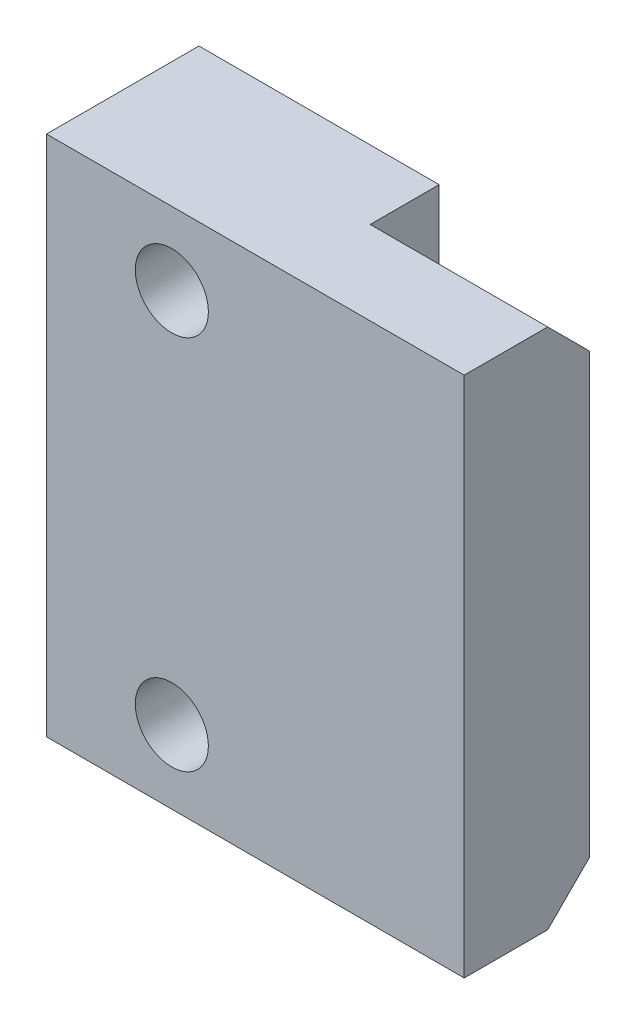
from build123d import *

# Parameters (mm, degrees)
BOSS_EXTRUDE1_DEPTH = 12.5
SKETCH2_R           = 1.75
CUT_EXTRUDE1_DEPTH  = 18.59374889
CHAMFER1_SIZE       = 2


with BuildPart() as part:
    # Sketch1 → Boss-Extrude1 (new, symmetric)
    with BuildSketch(Plane(origin=(0, 0, 0), x_dir=(1, 0, 0), z_dir=(0, 1, 0))):
        Polygon((-10, 7.3), (1.5, 7.3), (1.5, 6), (10, 6), (10, 0), (-10, 0), align=None)
    extrude(amount=BOSS_EXTRUDE1_DEPTH, both=True)

    # Sketch2 → Cut-Extrude1 (cut, through all)
    with BuildSketch(Plane.XY):
        with Locations((-4, 9)):
            Circle(SKETCH2_R)
        with Locations((-4, -9)):
            Circle(SKETCH2_R)
    extrude(amount=-CUT_EXTRUDE1_DEPTH, mode=Mode.SUBTRACT)

    # Chamfer1
    chamfer1_edges = [part.edges().sort_by_distance(p)[0] for p in [
        (5.75, 12.5, -6),
        (5.75, -12.5, -6),
    ]]
    chamfer(chamfer1_edges, length=CHAMFER1_SIZE)


solid = part.part
